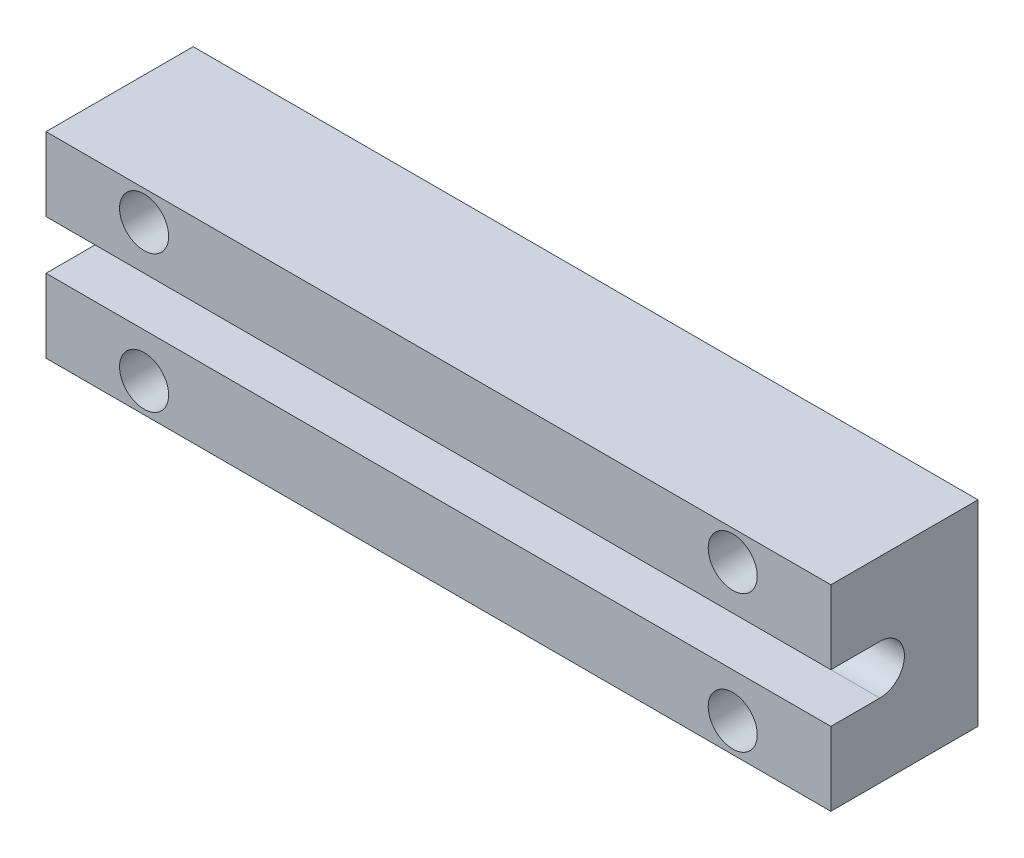
from build123d import *

# Parameters (mm, degrees)
ESQUISSE1_W             = 80
ESQUISSE1_H             = 20
BOSS_EXTRU_1_DEPTH      = 15
ENL_V_MAT_EXTRU_1_DEPTH = 94
ESQUISSE3_R             = 2.5
ENL_V_MAT_EXTRU_2_DEPTH = 94


with BuildPart() as part:
    # Esquisse1 → Boss.-Extru.1 (new body)
    with BuildSketch(Plane.XY):
        with Locations((-40, 10)):
            Rectangle(ESQUISSE1_W, ESQUISSE1_H)
    extrude(amount=BOSS_EXTRU_1_DEPTH)

    # Esquisse2 → Enlèv. mat.-Extru.1 (cut)
    with BuildSketch(Plane(origin=(0, 0, 0), x_dir=(0, 0, -1), z_dir=(1, 0, 0))):
        with BuildLine():
            Line((-15, 7.5), (-10, 7.5))
            ThreePointArc((-10, 7.5), (-7.5, 10), (-10, 12.5))
            Line((-10, 12.5), (-15, 12.5))
            Line((-15, 12.5), (-15, 7.5))
        make_face()
    extrude(amount=-ENL_V_MAT_EXTRU_1_DEPTH, mode=Mode.SUBTRACT)

    # Esquisse3 → Enlèv. mat.-Extru.2 (cut)
    with BuildSketch(Plane(origin=(0, 0, 0), x_dir=(-1, 0, 0), z_dir=(0, 0, -1))):
        with Locations((10, 17)):
            Circle(ESQUISSE3_R)
        with Locations((10, 3)):
            Circle(ESQUISSE3_R)
        with Locations((70, 17)):
            Circle(ESQUISSE3_R)
        with Locations((70, 3)):
            Circle(ESQUISSE3_R)
    extrude(amount=-ENL_V_MAT_EXTRU_2_DEPTH, mode=Mode.SUBTRACT)


solid = part.part
